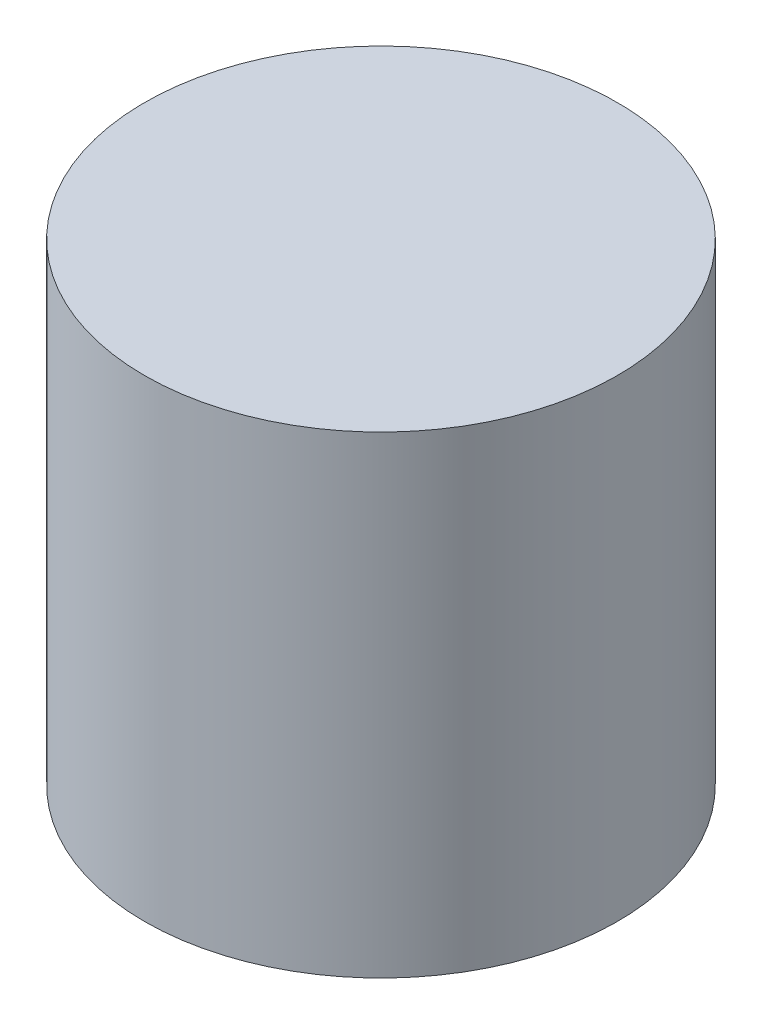
from build123d import *

# Parameters (mm, degrees)
SKETCH1_R           = 1.27
BOSS_EXTRUDE1_DEPTH = 2.54


with BuildPart() as part:
    # Sketch1 → Boss-Extrude1 (new body)
    with BuildSketch(Plane(origin=(0, 0, 0), x_dir=(1, 0, 0), z_dir=(0, 1, 0))):
        with Locations(Location((0, 0, 0), (0, 0, 270))):
            Circle(SKETCH1_R)
    extrude(amount=BOSS_EXTRUDE1_DEPTH)


solid = part.part
